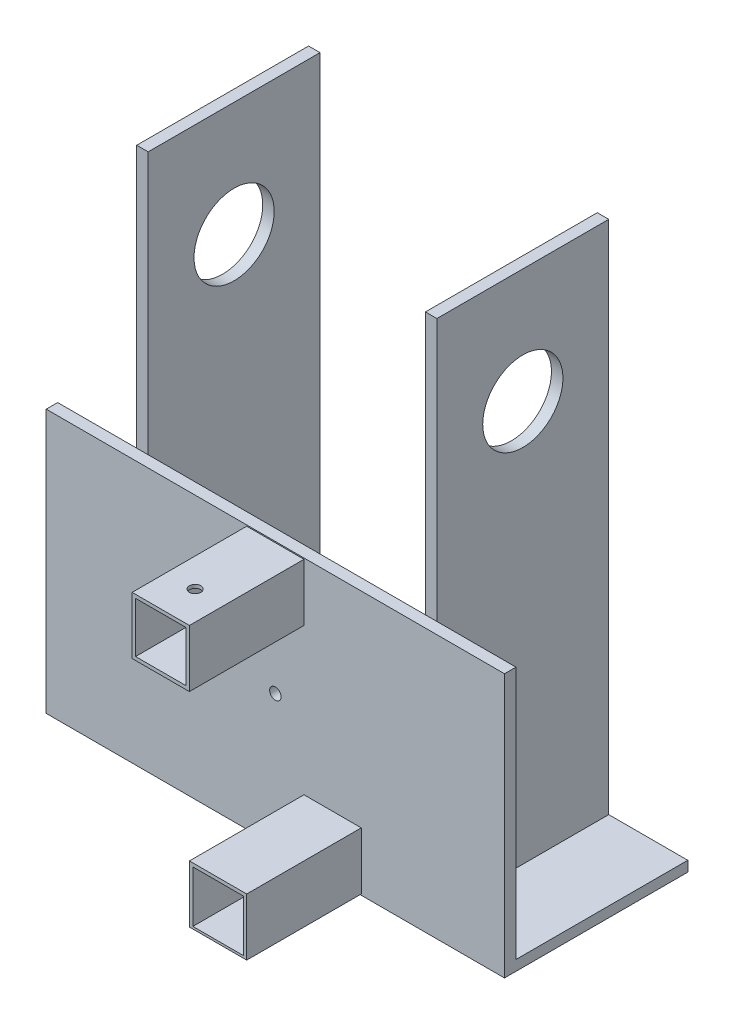
from build123d import *

# Parameters (mm, degrees)
ESBO_O1_W                = 400
ESBO_O1_H                = 150
RESSALTO_EXTRUS_O1_DEPTH = 9
ESBO_O2_W                = 10
ESBO_O2_H                = 150
RESSALTO_EXTRUS_O2_DEPTH = 450
ESBO_O5_R                = 35
CORTE_EXTRUS_O1_DEPTH    = 300
ESBO_O6_W                = 400
ESBO_O6_H                = 10
RESSALTO_EXTRUS_O4_DEPTH = 230
ESBO_O8_W                = 100
ESBO_O8_H                = 50
RESSALTO_EXTRUS_O5_DEPTH = 25
ESBO_O9_R                = 5
CORTE_EXTRUS_O3_DEPTH    = 50
ESBO_O7_R                = 5
CORTE_EXTRUS_O2_DEPTH    = 150
ESBO_O11_W               = 100
ESBO_O11_H               = 50
RESSALTO_EXTRUS_O6_DEPTH = 50
ESBO_O12_R               = 5
CORTE_EXTRUS_O4_DEPTH    = 30
ESBO_O13_W               = 44
ESBO_O13_H               = 45
ESBO_O13_H_2             = 44
CORTE_EXTRUS_O5_DEPTH    = 100
ESBO_O14_R               = 5
CORTE_EXTRUS_O6_DEPTH    = 10


with BuildPart() as part:
    # Esboço1 → Ressalto-extrusão1 (new body)
    with BuildSketch(Plane(origin=(0, 0, 0), x_dir=(1, 0, 0), z_dir=(0, 1, 0))):
        Rectangle(ESBO_O1_W, ESBO_O1_H)
    extrude(amount=RESSALTO_EXTRUS_O1_DEPTH)

    # Esboço2 → Ressalto-extrusão2 (add)
    with BuildSketch(Plane(origin=(0, 9, 0), x_dir=(1, 0, 0), z_dir=(0, 1, 0))):
        with Locations((-126, 0)):
            Rectangle(ESBO_O2_W, ESBO_O2_H)
        with Locations((126, 0)):
            Rectangle(ESBO_O2_W, ESBO_O2_H)
    extrude(amount=RESSALTO_EXTRUS_O2_DEPTH)

    # Esboço5 → Corte-extrusão1 (cut)
    with BuildSketch(Plane.ZY.offset(131)):
        with Locations((0, 359)):
            Circle(ESBO_O5_R)
    extrude(amount=-CORTE_EXTRUS_O1_DEPTH, mode=Mode.SUBTRACT)

    # Esboço6 → Ressalto-extrusão4 (add)
    with BuildSketch(Plane.XZ):
        with Locations((0, 80)):
            Rectangle(ESBO_O6_W, ESBO_O6_H)
    extrude(amount=-RESSALTO_EXTRUS_O4_DEPTH)

    # Esboço8 → Ressalto-extrusão5 (add, symmetric)
    with BuildSketch(Plane.ZY):
        with Locations((135, 204)):
            Rectangle(ESBO_O8_W, ESBO_O8_H)
    extrude(amount=RESSALTO_EXTRUS_O5_DEPTH, both=True)

    # Esboço9 → Corte-extrusão3 (cut)
    with BuildSketch(Plane(origin=(0, 230, 0), x_dir=(-1, 0, 0), z_dir=(0, 1, 0))):
        with Locations(Location((0, 155, 0), (0, 0, 90))):
            Circle(ESBO_O9_R)
    extrude(amount=-CORTE_EXTRUS_O3_DEPTH, mode=Mode.SUBTRACT)

    # Esboço7 → Corte-extrusão2 (cut)
    with BuildSketch(Plane(origin=(0, 0, 75), x_dir=(-1, 0, 0), z_dir=(0, 0, -1))):
        with Locations((0, 115)):
            Circle(ESBO_O7_R)
    extrude(amount=-CORTE_EXTRUS_O2_DEPTH, mode=Mode.SUBTRACT)

    # Esboço11 → Ressalto-extrusão6 (add)
    with BuildSketch(Plane.ZY.offset(-75)):
        with Locations((135, 26)):
            Rectangle(ESBO_O11_W, ESBO_O11_H)
    extrude(amount=RESSALTO_EXTRUS_O6_DEPTH)

    # Esboço12 → Corte-extrusão4 (cut)
    with BuildSketch(Plane.ZY.offset(-25)):
        with Locations((139.811131484, 26)):
            Circle(ESBO_O12_R)
    extrude(amount=-CORTE_EXTRUS_O4_DEPTH, mode=Mode.SUBTRACT)

    # Esboço13 → Corte-extrusão5 (cut)
    with BuildSketch(Plane.XY.offset(185)):
        with Locations((50, 25.5)):
            Rectangle(ESBO_O13_W, ESBO_O13_H)
        with Locations((0, 204)):
            Rectangle(ESBO_O13_W, ESBO_O13_H_2)
    extrude(amount=-CORTE_EXTRUS_O5_DEPTH, mode=Mode.SUBTRACT)

    # Esboço14 → Corte-extrusão6 (cut)
    with BuildSketch(Plane.XY.offset(85)):
        with Locations((0, 204)):
            Circle(ESBO_O14_R)
        with Locations((50, 25.5)):
            Circle(ESBO_O14_R)
    extrude(amount=-CORTE_EXTRUS_O6_DEPTH, mode=Mode.SUBTRACT)


solid = part.part
